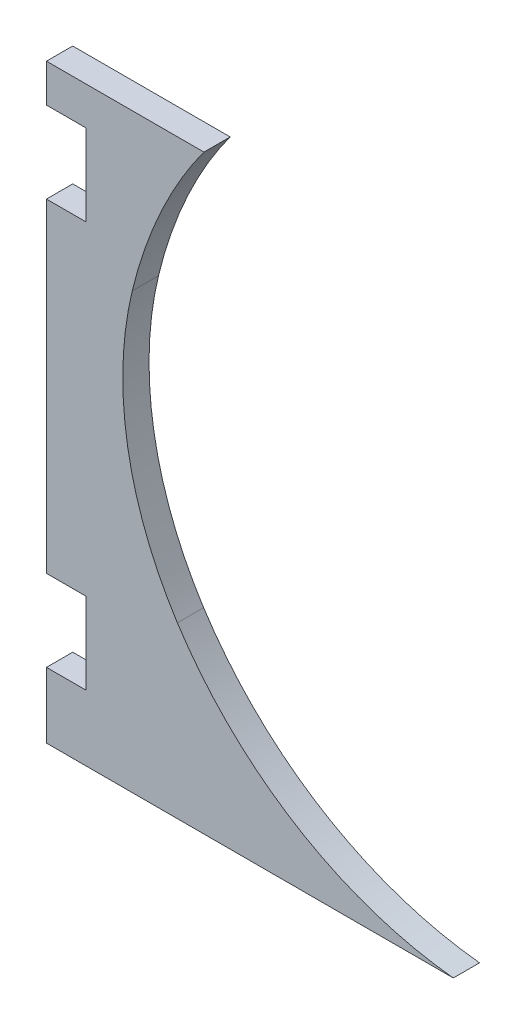
from build123d import *

# Parameters (mm, degrees)
SKETCH1_W           = 140
SKETCH1_H           = 225
BOSS_EXTRUDE1_DEPTH = 10
CUT_EXTRUDE1_DEPTH  = 10
FILLET1_R           = 130
SKETCH3_W           = 10
SKETCH3_H           = 225
BOSS_EXTRUDE2_DEPTH = 15
SKETCH4_W           = 15
SKETCH4_H           = 31
CUT_EXTRUDE3_DEPTH  = 142.355049579


with BuildPart() as part:
    # Sketch1 → Boss-Extrude1 (new body)
    with BuildSketch(Plane.XY):
        Rectangle(SKETCH1_W, SKETCH1_H)
    extrude(amount=BOSS_EXTRUDE1_DEPTH)

    # Sketch2 → Cut-Extrude1 (cut)
    with BuildSketch(Plane.XY.offset(10)):
        with BuildLine():
            Line((70, 112.5), (-25, 112.5))
            add(Edge.make_bspline(
                [(-57, 12.829167661), (-57.230920503, 51.908636371), (-43.499555568, 87.434937954), (-25, 112.5)],
                knots=[0, 0, 0, 0, 1, 1, 1, 1], degree=3))
            Line((-57, 12.829167661), (70, -112.5))
            Line((70, -112.5), (70, 112.5))
        make_face()
        with BuildLine():
            Line((-57, 12.829167661), (70, -112.5))
            ThreePointArc((70, -112.5), (-15.444512377, -72.072482958), (-57, 12.829167661))
        make_face()
    extrude(amount=-CUT_EXTRUDE1_DEPTH, mode=Mode.SUBTRACT)

    # Fillet1
    fillet1_edges = [part.edges().sort_by_distance(p)[0] for p in [
        (-57, 12.829167661, 5),
    ]]
    fillet(fillet1_edges, radius=FILLET1_R)

    # Sketch3 → Boss-Extrude2 (add)
    with BuildSketch(Plane.ZY.offset(70)):
        with Locations((5, 0)):
            Rectangle(SKETCH3_W, SKETCH3_H)
    extrude(amount=BOSS_EXTRUDE2_DEPTH)

    # Sketch4 → Cut-Extrude3 (cut, through all)
    with BuildSketch(Plane(origin=(0, 0, 0), x_dir=(-1, 0, 0), z_dir=(0, 0, -1))):
        with Locations((77.5, 82.5)):
            Rectangle(SKETCH4_W, SKETCH4_H)
        with Locations((77.5, -72)):
            Rectangle(SKETCH4_W, SKETCH4_H)
    extrude(amount=-CUT_EXTRUDE3_DEPTH, mode=Mode.SUBTRACT)


solid = part.part
